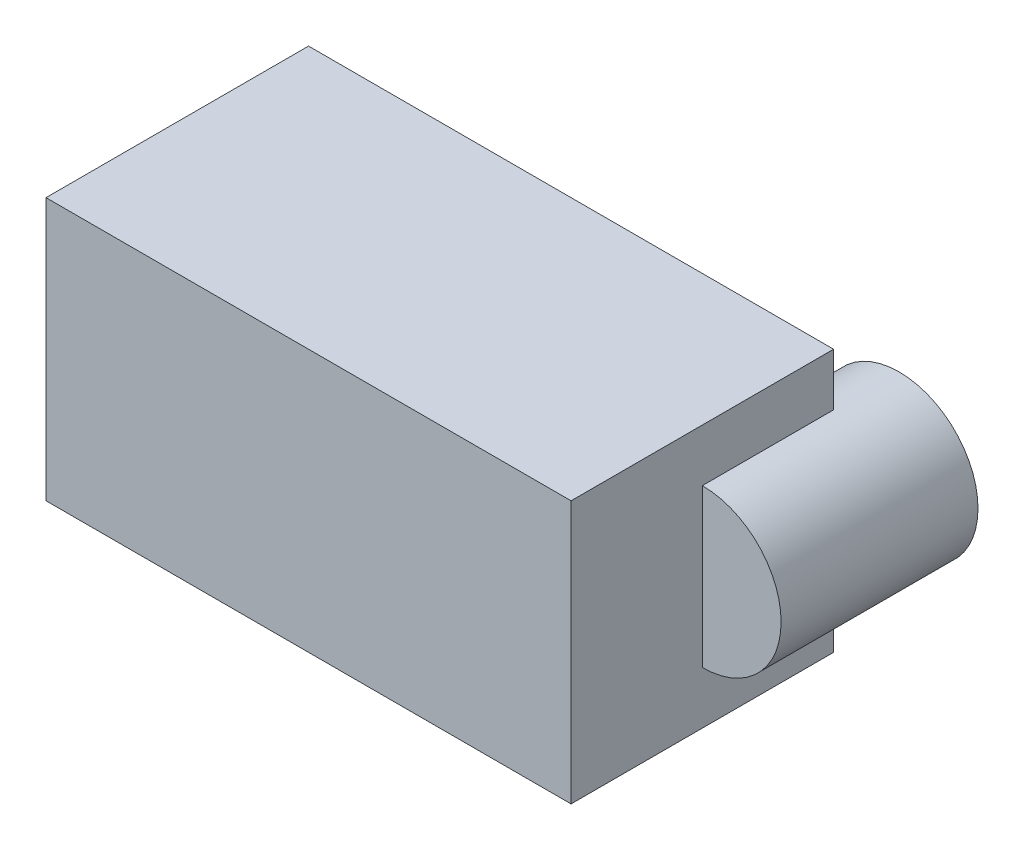
from build123d import *

# Parameters (mm, degrees)
SKETCH1_W           = 40
SKETCH1_H           = 20
BOSS_EXTRUDE1_DEPTH = 10
SKETCH2_R           = 6
BOSS_EXTRUDE2_DEPTH = 15


with BuildPart() as part:
    # Sketch1 → Boss-Extrude1 (new, symmetric)
    with BuildSketch(Plane.XY):
        with Locations((20, 10)):
            Rectangle(SKETCH1_W, SKETCH1_H)
    extrude(amount=BOSS_EXTRUDE1_DEPTH, both=True)

    # Sketch2 → Boss-Extrude2 (add)
    with BuildSketch(Plane.XY):
        with Locations((40, 10)):
            Circle(SKETCH2_R)
    extrude(amount=-BOSS_EXTRUDE2_DEPTH)


solid = part.part
